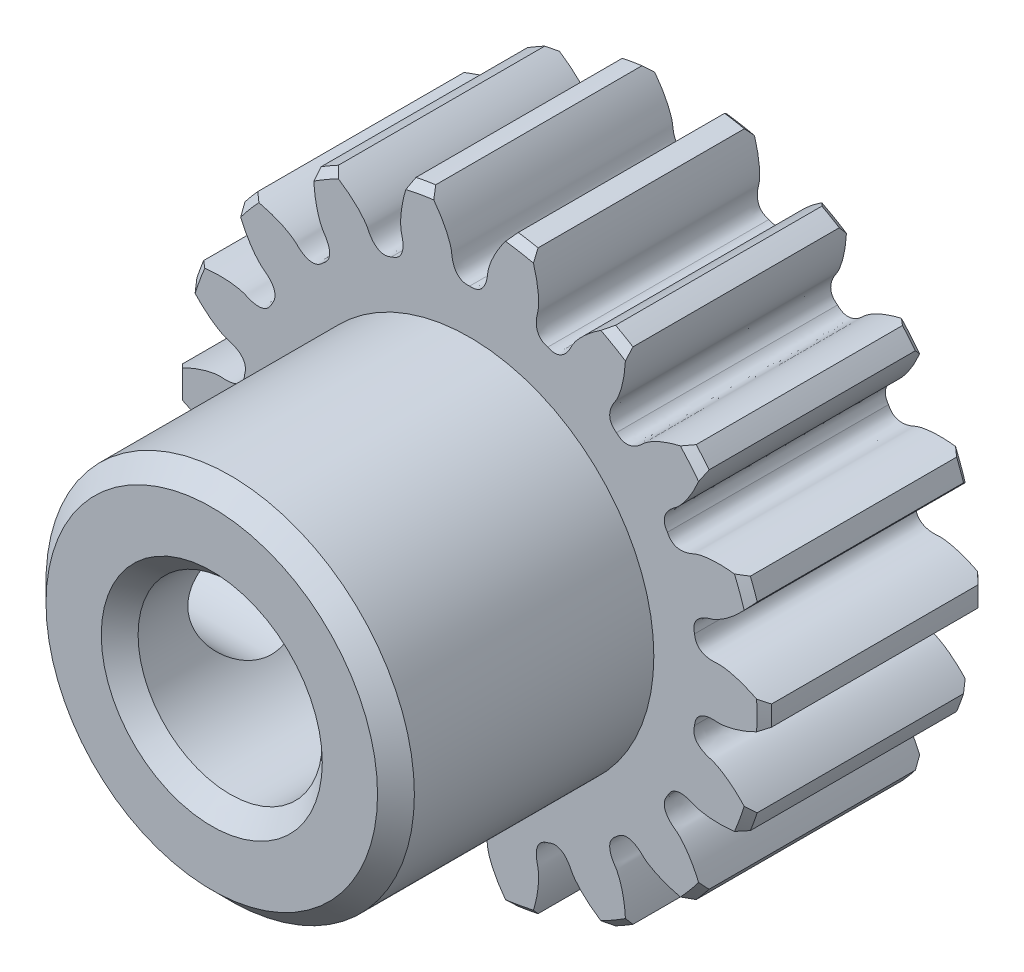
from build123d import *

# Parameters (mm, degrees)
GEAR_BASESKETCH_R                            = 8
F_0_8_MODULE_14_4000MM_P_D_DEPTH             = 3
TOOTH_CUT_COARSE_PITCH_INVOLUTE_20_DEG_DEPTH = 12.704699911
CHAMFER_705_SIZE                             = 0.2
TOOTH_PATTERN_18_18_COUNT                    = 18
SKETCH3_R                                    = 5
SKETCH3_R_2                                  = 2.5
EXTRUDE_1092_DEPTH                           = 7
SKETCH4_R                                    = 5
CUT_EXTRUDE_1363_DEPTH                       = 3
CUT_EXTRUDE_START                            = -3
SKETCH5_R                                    = 2.5
CUT_EXTRUDE_1606_DEPTH                       = 3
CHAMFER_1993_SIZE                            = 0.5
SKETCH6_R                                    = 1.65
CUT_EXTRUDE_2180_DEPTH                       = 4


with BuildPart() as part:
    # Gear-BaseSketch → 0.8 Module, 14,4000mm P.D. (new, symmetric)
    with BuildSketch(Plane.XY):
        Circle(GEAR_BASESKETCH_R)
    extrude(amount=F_0_8_MODULE_14_4000MM_P_D_DEPTH, both=True)

    # Tooth-Sketch; Backlash: 0,0000mm → Tooth-Cut, Coarse Pitch Involute 20 deg (cut, symmetric)
    with BuildSketch(Plane.XY):
        with BuildLine():
            ThreePointArc((-1.188717893, 8.000402693), (0, 8.08823179), (1.188717893, 8.000402693))
            add(Edge.make_bspline(
                [(1.188717893, 8.000402693), (1.108648495, 7.910450075), (0.998051204, 7.775624837), (0.868218399, 7.593430674), (0.787430611, 7.468912514), (0.718690931, 7.352116281), (0.661158946, 7.243835289), (0.61394864, 7.144803658), (0.5761317, 7.055693938), (0.546743771, 6.977114679), (0.524780351, 6.909609135), (0.509223911, 6.853651433), (0.498984499, 6.809650608), (0.493066583, 6.777934881), (0.490211937, 6.7587825), (0.488695415, 6.743519506), (0.486805922, 6.719579905), (0.482887828, 6.68328409), (0.474494991, 6.626197091), (0.460215171, 6.558499473), (0.436128003, 6.481824546), (0.404160225, 6.41014801), (0.361738483, 6.3426302), (0.304204321, 6.279928162), (0.190373189, 6.202235676), (0.075511388, 6.193069225), (0, 6.199445465)],
                knots=[0, 0, 0, 0, 0.157961946, 0.228480673, 0.293357902, 0.352593633, 0.406187867, 0.454140604, 0.496451843, 0.533121585, 0.56414983, 0.589536579, 0.609281832, 0.623385592, 0.631847864, 0.634668687, 0.643502696, 0.663346333, 0.682538951, 0.719174427, 0.753969949, 0.787768004, 0.82185533, 0.858103523, 0.898741151, 1, 1, 1, 1], degree=3))
            add(Edge.make_bspline(
                [(-1.188717893, 8.000402693), (-1.108648495, 7.910450075), (-0.998051204, 7.775624837), (-0.868218399, 7.593430674), (-0.787430611, 7.468912514), (-0.718690931, 7.352116281), (-0.661158946, 7.243835289), (-0.61394864, 7.144803658), (-0.5761317, 7.055693938), (-0.546743771, 6.977114679), (-0.524780351, 6.909609135), (-0.509223911, 6.853651433), (-0.498984499, 6.809650608), (-0.493066583, 6.777934881), (-0.490211937, 6.7587825), (-0.488695415, 6.743519506), (-0.486805922, 6.719579905), (-0.482887828, 6.68328409), (-0.474494991, 6.626197091), (-0.460215171, 6.558499473), (-0.436128003, 6.481824546), (-0.404160225, 6.41014801), (-0.361738483, 6.3426302), (-0.304204321, 6.279928162), (-0.190373189, 6.202235676), (-0.075511388, 6.193069225), (0, 6.199445465)],
                knots=[0, 0, 0, 0, 0.157961946, 0.228480673, 0.293357902, 0.352593633, 0.406187867, 0.454140604, 0.496451843, 0.533121585, 0.56414983, 0.589536579, 0.609281832, 0.623385592, 0.631847864, 0.634668687, 0.643502696, 0.663346333, 0.682538951, 0.719174427, 0.753969949, 0.787768004, 0.82185533, 0.858103523, 0.898741151, 1, 1, 1, 1], degree=3))
        make_face()
    tooth_cut_coarse_pitch_involute_20_deg = extrude(amount=TOOTH_CUT_COARSE_PITCH_INVOLUTE_20_DEG_DEPTH, both=True, mode=Mode.SUBTRACT)

    # Chamfer 705
    chamfer_705_edges = [part.edges().sort_by_distance(p)[0] for p in [
        (0, -8, -3),
        (0, -8, 3),
    ]]
    chamfer(chamfer_705_edges, length=CHAMFER_705_SIZE)

    # Tooth Pattern, 18 / 18: Tooth-Cut, Coarse Pitch Involute 20 deg ×18 about axis
    tooth_pattern_18_18_axis = Axis((0, 0, -4.277017338), (0, 0, 1))
    for i in range(1, TOOTH_PATTERN_18_18_COUNT):
        add(tooth_cut_coarse_pitch_involute_20_deg.rotate(tooth_pattern_18_18_axis, i * 360 / TOOTH_PATTERN_18_18_COUNT), mode=Mode.SUBTRACT)

    # Sketch3 → Extrude 1092 (add)
    with BuildSketch(Plane.XY.offset(3)):
        Circle(SKETCH3_R)
        Circle(SKETCH3_R_2, mode=Mode.SUBTRACT)
    extrude(amount=EXTRUDE_1092_DEPTH)

    # Sketch4 → Cut-Extrude 1363 (cut)
    with BuildSketch(Plane(origin=(0, 0, -3), x_dir=(-1, 0, 0), z_dir=(0, 0, -1))):
        Circle(SKETCH4_R)
    extrude(amount=-CUT_EXTRUDE_1363_DEPTH, mode=Mode.SUBTRACT)

    # Sketch5 → Cut-Extrude 1606 (cut)
    with BuildSketch(Plane.XY.offset(3).offset(CUT_EXTRUDE_START)):
        Circle(SKETCH5_R)
    extrude(amount=CUT_EXTRUDE_1606_DEPTH, mode=Mode.SUBTRACT)

    # Chamfer 1993
    chamfer_1993_edges = [part.edges().sort_by_distance(p)[0] for p in [
        (-5, 0, 10),
        (-2.5, 0, 10),
        (5, 0, -3),
        (-2.5, 0, 0),
    ]]
    chamfer(chamfer_1993_edges, length=CHAMFER_1993_SIZE)

    # Sketch6 → Cut-Extrude 2180 (cut)
    with BuildSketch(Plane.ZY.offset(5)):
        with Locations((6.5, 0)):
            Circle(SKETCH6_R)
    extrude(amount=-CUT_EXTRUDE_2180_DEPTH, mode=Mode.SUBTRACT)


solid = part.part
